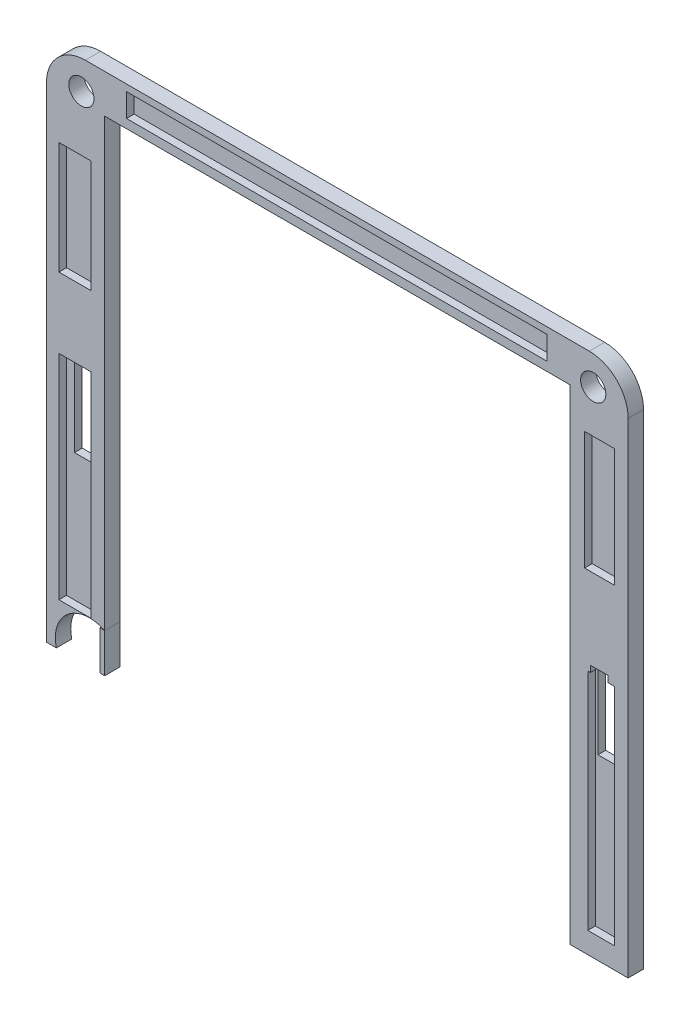
from build123d import *

# Parameters (mm, degrees)
SKETCH2_W           = 120
SKETCH2_H           = 115
BOSS_EXTRUDE1_DEPTH = 152
SKETCH3_W           = 120
SKETCH3_H           = 13.389184999
CUT_EXTRUDE1_DEPTH  = 192.155706765
SKETCH5_R           = 3.25
CUT_EXTRUDE2_DEPTH  = 30
SKETCH6_W           = 4.5
SKETCH6_H           = 21
CUT_EXTRUDE4_DEPTH  = 16
SKETCH7_R           = 3.25
CUT_EXTRUDE5_DEPTH  = 15
SKETCH8_W           = 8.291807731
SKETCH8_H           = 28.961241497
SKETCH8_H_2         = 55.038375958
SKETCH8_W_2         = 108.394356143
SKETCH8_H_3         = 6.008556327
SKETCH8_W_3         = 7.690952099
SKETCH8_H_4         = 30.523466142
SKETCH8_W_4         = 6.849754213
SKETCH8_H_5         = 57.922482994
CUT_EXTRUDE6_DEPTH  = 150
CUT_EXTRUDE7_DEPTH  = 192.155706765
SKETCH10_W          = 148.03445097
SKETCH10_H          = 135
CUT_EXTRUDE8_DEPTH  = 226.028821495


with BuildPart() as part:
    # Sketch2 → Boss-Extrude1 (new body)
    with BuildSketch(Plane.XY):
        with BuildLine():
            Line((-48.334664537, 64.049520767), (81.665335463, 64.049520767))
            ThreePointArc((81.665335463, 64.049520767), (88.736403275, 61.120588579), (91.665335463, 54.049520767))
            Line((91.665335463, 54.049520767), (91.665335463, -70.950479233))
            Line((91.665335463, -70.950479233), (-58.334664537, -70.950479233))
            Line((-58.334664537, -70.950479233), (-58.334664537, 54.049520767))
            ThreePointArc((-58.334664537, 54.049520767), (-55.405732349, 61.120588579), (-48.334664537, 64.049520767))
        make_face()
        with Locations((16.665335463, -3.450479233)):
            Rectangle(SKETCH2_W, SKETCH2_H, mode=Mode.SUBTRACT)
    extrude(amount=BOSS_EXTRUDE1_DEPTH)

    # Sketch3 → Cut-Extrude1 (cut, through all)
    with BuildSketch(Plane.XY.offset(152)):
        with Locations((16.665335463, -67.645071732)):
            Rectangle(SKETCH3_W, SKETCH3_H)
    extrude(amount=-CUT_EXTRUDE1_DEPTH, mode=Mode.SUBTRACT)

    # Sketch5 → Cut-Extrude2 (cut)
    with BuildSketch(Plane(origin=(0, 0, 0), x_dir=(-1, 0, 0), z_dir=(0, 0, -1))):
        with Locations((-82.665335463, 56.549520767)):
            Circle(SKETCH5_R)
        with Locations((49.334664537, 56.549520767)):
            Circle(SKETCH5_R)
    extrude(amount=-CUT_EXTRUDE2_DEPTH, mode=Mode.SUBTRACT)

    # Sketch6 → Cut-Extrude4 (cut)
    with BuildSketch(Plane(origin=(0, 0, 0), x_dir=(-1, 0, 0), z_dir=(0, 0, -1))):
        with Locations((50.834664537, -16.450479233)):
            Rectangle(SKETCH6_W, SKETCH6_H)
        with Locations((-84.165335463, -16.450479233)):
            Rectangle(SKETCH6_W, SKETCH6_H)
    extrude(amount=-CUT_EXTRUDE4_DEPTH, mode=Mode.SUBTRACT)

    # Sketch7 → Cut-Extrude5 (cut)
    with BuildSketch(Plane.XY.offset(152)):
        with Locations((-50.834664537, 55.049520767)):
            Circle(SKETCH7_R)
        with Locations((-50.834664537, 4.049520767)):
            Circle(SKETCH7_R)
        with Locations((84.165335463, 4.049520767)):
            Circle(SKETCH7_R)
        with Locations((84.165335463, 55.049520767)):
            Circle(SKETCH7_R)
    extrude(amount=-CUT_EXTRUDE5_DEPTH, mode=Mode.SUBTRACT)

    # Sketch8 → Cut-Extrude6 (cut)
    with BuildSketch(Plane.XY.offset(152)):
        with Locations((-50.991008781, 27.795371112)):
            Rectangle(SKETCH8_W, SKETCH8_H)
        with Locations((-50.991008781, -32.350277723)):
            Rectangle(SKETCH8_W, SKETCH8_H_2)
        with Locations((16.485078773, 59.340291831)):
            Rectangle(SKETCH8_W_2, SKETCH8_H_3)
        with Locations((84.261594145, 30.258879207)):
            Rectangle(SKETCH8_W_3, SKETCH8_H_4)
        with Locations((84.682193087, -36.556267152)):
            Rectangle(SKETCH8_W_4, SKETCH8_H_5)
    extrude(amount=-CUT_EXTRUDE6_DEPTH, mode=Mode.SUBTRACT)

    # Sketch9 → Cut-Extrude7 (cut, through all)
    with BuildSketch(Plane.XY.offset(152)):
        with BuildLine():
            Line((-55.78242584, -70.950479233), (-44.573216516, -70.950479233))
            Line((-44.573216516, -70.950479233), (-44.573216516, -60.861864812))
            Line((-44.573216516, -60.861864812), (-43.334664537, -60.861864812))
            ThreePointArc((-43.334664537, -60.861864812), (-52.78845028, -61.92097783), (-55.78242584, -70.950479233))
        make_face()
    extrude(amount=-CUT_EXTRUDE7_DEPTH, mode=Mode.SUBTRACT)


with BuildPart() as cut_extrude7_piece_1:
    # of the separate pieces the step leaves, piece 1, a body of its own (cut_extrude7_pieces)
    add(part.part.solids().sort_by_distance((-48.334664537, 64.049520767, 0))[0])


with BuildPart() as cut_extrude7_piece_2:
    # of the separate pieces the step leaves, piece 2, a body of its own (cut_extrude7_pieces)
    add(part.part.solids().sort_by_distance((-43.334664537, -70.950479233, 0))[0])


with BuildPart() as cut_extrude8_tool:
    # Sketch10 → Cut-Extrude8 (new, through all)
    with BuildSketch(Plane(origin=(91.665335463, 0, 0), x_dir=(0, 0, -1), z_dir=(1, 0, 0))):
        with Locations((-77.982774515, -3.450479233)):
            Rectangle(SKETCH10_W, SKETCH10_H)
    extrude(amount=-CUT_EXTRUDE8_DEPTH)


with BuildPart() as cut_extrude7_piece_1_1:
    add(cut_extrude7_piece_1.part)

    # Cut-Extrude8: cut by cut_extrude8_tool
    add(cut_extrude8_tool.part, mode=Mode.SUBTRACT)


with BuildPart() as cut_extrude7_piece_2_1:
    add(cut_extrude7_piece_2.part)

    # Cut-Extrude8: cut by cut_extrude8_tool
    add(cut_extrude8_tool.part, mode=Mode.SUBTRACT)


solid = Compound([cut_extrude7_piece_1_1.part, cut_extrude7_piece_2_1.part])
